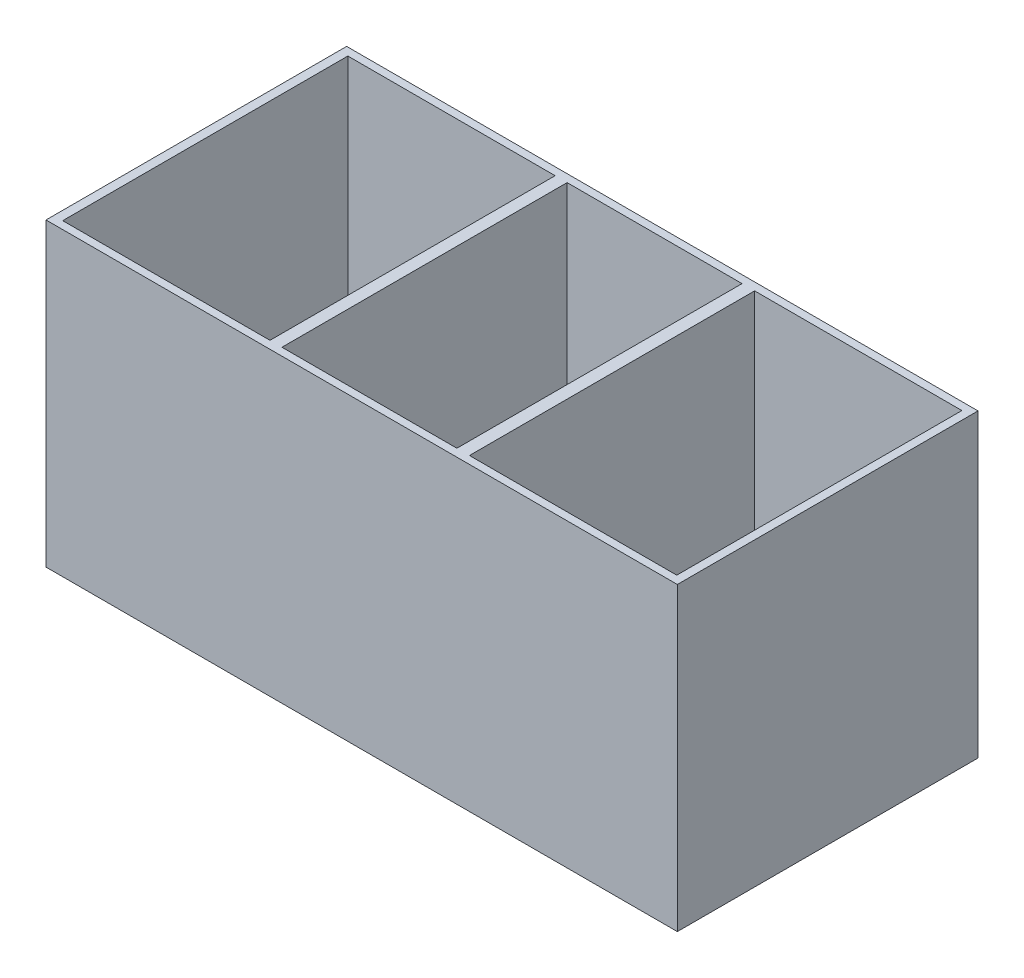
from build123d import *

# Parameters (mm, degrees)
SKETCH1_W           = 210
SKETCH1_H           = 100
BOSS_EXTRUDE1_DEPTH = 100
SKETCH2_W           = 68.943627593
SKETCH2_H           = 94.8473027
SKETCH2_W_2         = 58.183639472
CUT_EXTRUDE1_DEPTH  = 95


with BuildPart() as part:
    # Sketch1 → Boss-Extrude1 (new body)
    with BuildSketch(Plane(origin=(0, 0, 0), x_dir=(1, 0, 0), z_dir=(0, 1, 0))):
        Rectangle(SKETCH1_W, SKETCH1_H)
    extrude(amount=BOSS_EXTRUDE1_DEPTH)

    # Sketch2 → Cut-Extrude1 (cut)
    with BuildSketch(Plane(origin=(0, 100, 0), x_dir=(1, 0, 0), z_dir=(0, 1, 0))):
        with Locations((-67.548814319, 0)):
            Rectangle(SKETCH2_W, SKETCH2_H)
        Rectangle(SKETCH2_W_2, SKETCH2_H)
        with Locations((67.748073358, 0)):
            Rectangle(SKETCH2_W, SKETCH2_H)
    extrude(amount=-CUT_EXTRUDE1_DEPTH, mode=Mode.SUBTRACT)


solid = part.part
